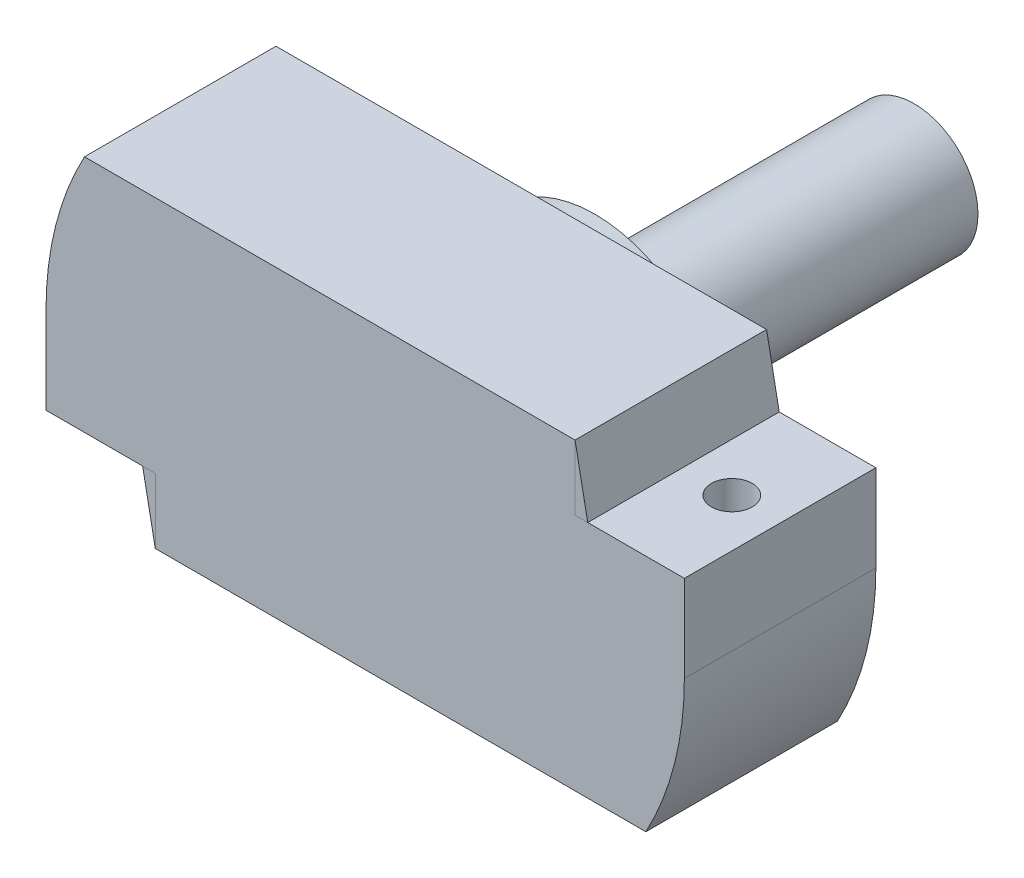
from build123d import *

# Parameters (mm, degrees)
SKETCH_1_R          = 5
EXTRUDE_1_DEPTH     = 25
SKETCH_2_R          = 10
EXTRUDE_2_DEPTH     = 3
SKETCH_3_W          = 50
SKETCH_3_H          = 23.8
EXTRUDE_3_DEPTH     = 15
CUT_EXTRUDE_1_DEPTH = 52.143034716
SKETCH_5_W          = 8.56
SKETCH_5_H          = 15
CUT_EXTRUDE_2_DEPTH = 5.1
SKETCH_6_R          = 1.6
CUT_EXTRUDE_3_DEPTH = 10
SKETCH_7_W          = 8.56
SKETCH_7_H          = 15
CUT_EXTRUDE_4_DEPTH = 5.1
SKETCH_8_R          = 1.6
CUT_EXTRUDE_5_DEPTH = 10
EXTRUDE_4_DEPTH     = 15
EXTRUDE_4_2_DEPTH   = 15


with BuildPart() as part:
    # 草图1 → 凸台-拉伸1 (new body)
    with BuildSketch(Plane.XY):
        Circle(SKETCH_1_R)
    extrude(amount=EXTRUDE_1_DEPTH)

    # 草图2 → 凸台-拉伸2 (add)
    with BuildSketch(Plane.XY.offset(25)):
        Circle(SKETCH_2_R)
    extrude(amount=EXTRUDE_2_DEPTH)

    # 草图3 → 凸台-拉伸3 (add)
    with BuildSketch(Plane.XY.offset(28)):
        Rectangle(SKETCH_3_W, SKETCH_3_H)
    extrude(amount=EXTRUDE_3_DEPTH)

    # 草图4 → 切除-拉伸1 (cut, through all)
    with BuildSketch(Plane.XY.offset(43)):
        with BuildLine():
            Line((-25, 11.9), (-25, 0))
            ThreePointArc((-25, 0), (-24.234823084, 6.137862013), (-21.986131993, 11.9))
            Line((-21.986131993, 11.9), (-25, 11.9))
        make_face()
        with BuildLine():
            Line((21.986131993, -11.9), (25, -11.9))
            Line((25, -11.9), (25, 0))
            ThreePointArc((25, 0), (24.234823084, -6.137862013), (21.986131993, -11.9))
        make_face()
    extrude(amount=-CUT_EXTRUDE_1_DEPTH, mode=Mode.SUBTRACT)

    # 草图5 → 切除-拉伸2 (cut)
    with BuildSketch(Plane(origin=(0, 11.9, 0), x_dir=(1, 0, 0), z_dir=(0, 1, 0))):
        with Locations((20.72, -35.5)):
            Rectangle(SKETCH_5_W, SKETCH_5_H)
    extrude(amount=-CUT_EXTRUDE_2_DEPTH, mode=Mode.SUBTRACT)

    # 草图6 → 切除-拉伸3 (cut)
    with BuildSketch(Plane(origin=(0, 6.8, 0), x_dir=(1, 0, 0), z_dir=(0, 1, 0))):
        with Locations(Location((21.22, -35.5, 0), (0, 0, 270))):
            Circle(SKETCH_6_R)
    extrude(amount=-CUT_EXTRUDE_3_DEPTH, mode=Mode.SUBTRACT)

    # 草图7 → 切除-拉伸4 (cut)
    with BuildSketch(Plane.XZ.offset(11.9)):
        with Locations((-20.72, 35.5)):
            Rectangle(SKETCH_7_W, SKETCH_7_H)
    extrude(amount=-CUT_EXTRUDE_4_DEPTH, mode=Mode.SUBTRACT)

    # 草图8 → 切除-拉伸5 (cut)
    with BuildSketch(Plane.XZ.offset(6.8)):
        with Locations(Location((-21.22, 35.5, 0), (0, 0, 270))):
            Circle(SKETCH_8_R)
    extrude(amount=-CUT_EXTRUDE_5_DEPTH, mode=Mode.SUBTRACT)


with BuildPart() as body_2:
    # 草图9 → 凸台-拉伸4 (new body)
    with BuildSketch(Plane.XY.offset(43)):
        Polygon((16.44, 11.9), (17.431339577, 6.8), (16.44, 6.8), align=None)
    extrude(amount=-EXTRUDE_4_DEPTH)


with BuildPart() as body_3:
    # 草图9 → Extrude 4 2 (new body)
    with BuildSketch(Plane.XY.offset(43)):
        Polygon((-16.44, -11.9), (-17.431339577, -6.8), (-16.44, -6.8), align=None)
    extrude(amount=-EXTRUDE_4_2_DEPTH)


solid = Compound([part.part, body_2.part, body_3.part])
